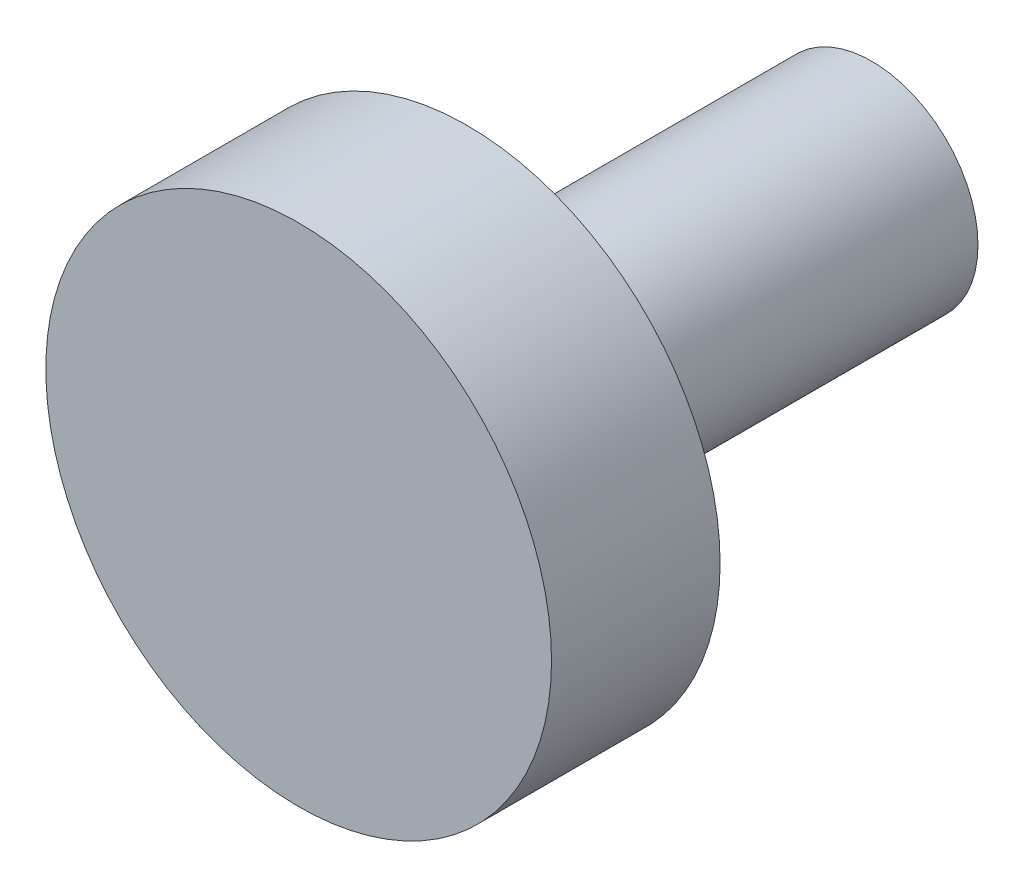
from build123d import *

# Parameters (mm, degrees)
SKETCH1_R           = 9.525
BOSS_EXTRUDE1_DEPTH = 6.35
SKETCH2_R           = 4
BOSS_EXTRUDE2_DEPTH = 15.24


with BuildPart() as part:
    # Sketch1 → Boss-Extrude1 (new body)
    with BuildSketch(Plane.XY):
        Circle(SKETCH1_R)
    extrude(amount=BOSS_EXTRUDE1_DEPTH)

    # Sketch2 → Boss-Extrude2 (add)
    with BuildSketch(Plane.XY):
        Circle(SKETCH2_R)
    extrude(amount=-BOSS_EXTRUDE2_DEPTH)


solid = part.part
